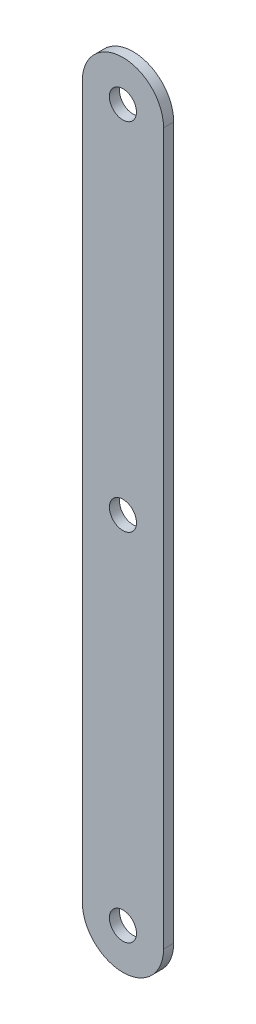
from build123d import *

# Parameters (mm, degrees)
IZIM1_R                     = 4
Y_KSEKLIK_EKSTR_ZYON1_DEPTH = 3


with BuildPart() as part:
    # Çizim1 → Yükseklik-Ekstrüzyon1 (new body)
    with BuildSketch(Plane(origin=(0, 0, -1.5), x_dir=(-1, 0, 0), z_dir=(0, 0, -1))):
        with BuildLine():
            Line((12, -105), (12, 105))
            ThreePointArc((12, 105), (0, 117), (-12, 105))
            Line((-12, 105), (-12, -105))
            ThreePointArc((-12, -105), (0, -117), (12, -105))
        make_face()
        with Locations(Location((0, -105, 0), (0, 0, 180))):
            Circle(IZIM1_R, mode=Mode.SUBTRACT)
        with Locations(Location((0, 0, 0), (0, 0, 180))):
            Circle(IZIM1_R, mode=Mode.SUBTRACT)
        with Locations(Location((0, 105, 0), (0, 0, 180))):
            Circle(IZIM1_R, mode=Mode.SUBTRACT)
    extrude(amount=-Y_KSEKLIK_EKSTR_ZYON1_DEPTH)


solid = part.part
